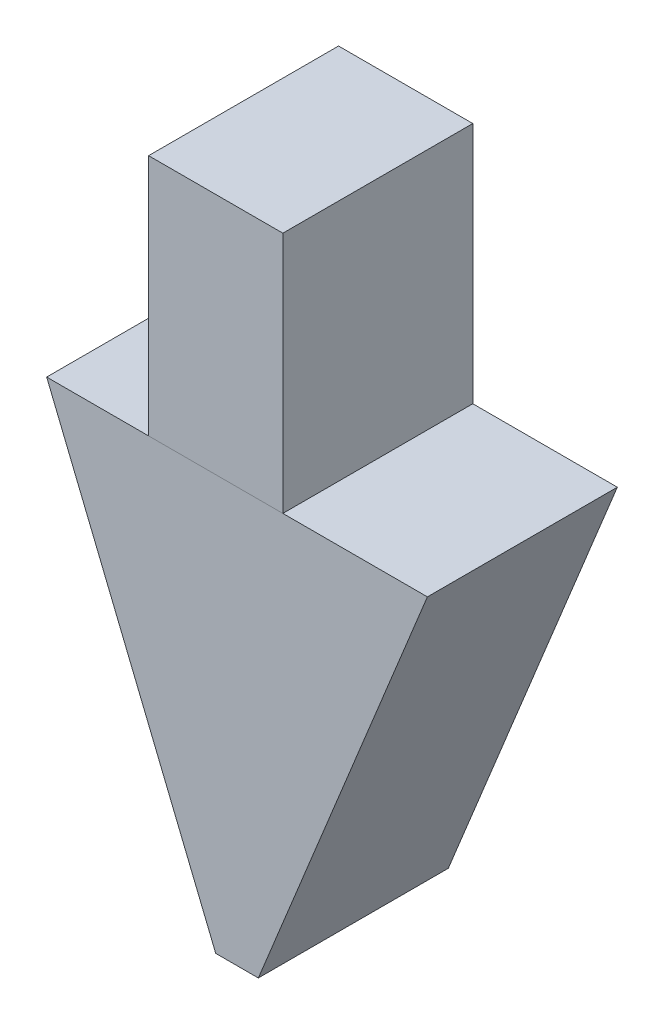
from build123d import *

# Parameters (mm, degrees)
BOSS_EXTRUDE1_DEPTH = 200
SKETCH2_W           = 282.737523313
SKETCH2_H           = 511.10244599
BOSS_EXTRUDE2_DEPTH = 200


with BuildPart() as part:
    # Sketch1 → Boss-Extrude1 (new, symmetric)
    with BuildSketch(Plane.XY):
        Polygon((-44.874846432, 0), (44.874846432, 0), (400.886986463, 873.148089651), (-400.886986463, 873.148089651), align=None)
    extrude(amount=BOSS_EXTRUDE1_DEPTH, both=True)


with BuildPart() as body_2:
    # Sketch2 → Boss-Extrude2 (new, symmetric)
    with BuildSketch(Plane.XY):
        with Locations((-44.874846433, 1128.699312646)):
            Rectangle(SKETCH2_W, SKETCH2_H)
    extrude(amount=BOSS_EXTRUDE2_DEPTH, both=True)


solid = Compound([part.part, body_2.part])
